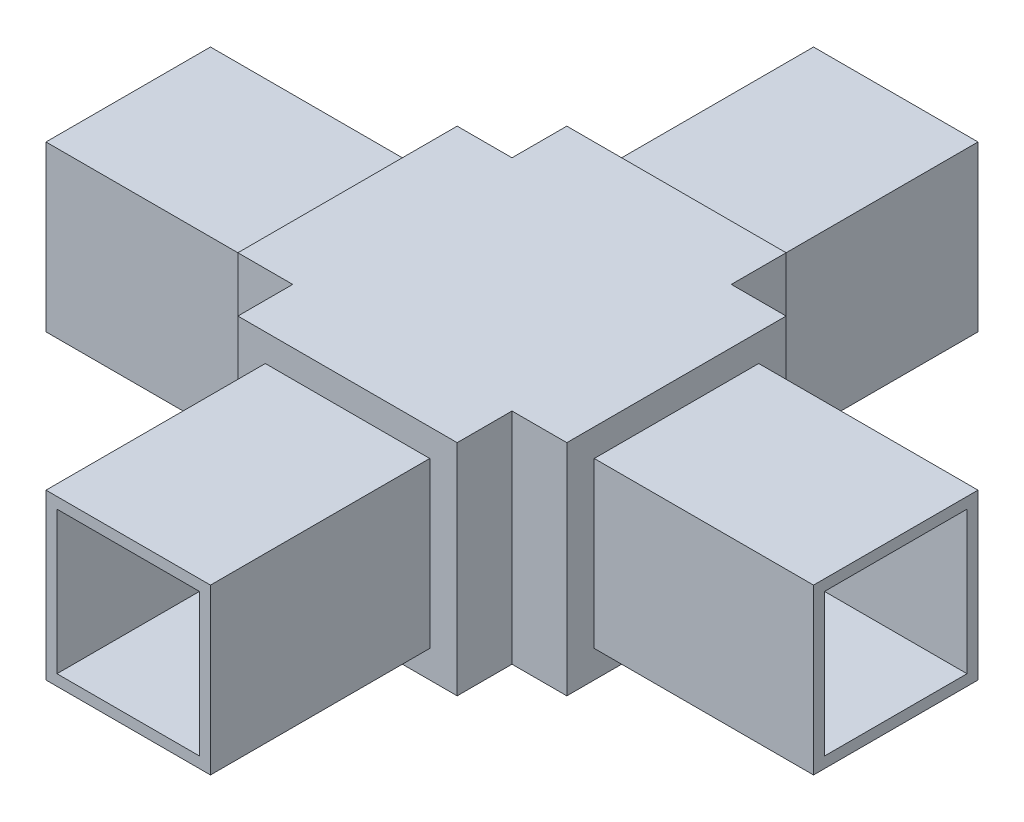
from build123d import *

# Parameters (mm, degrees)
CROQUIS1_W     = 40
CROQUIS1_H     = 50
CROQUIS1_H_2   = 40
CROQUIS1_W_2   = 50
EXTRUIR1_DEPTH = 40
CROQUIS2_W     = 40
CROQUIS2_H     = 40
CROQUIS2_W_2   = 30
CROQUIS2_H_2   = 30
EXTRUIR2_DEPTH = 40
CROQUIS3_W     = 40
CROQUIS3_H     = 40
CROQUIS3_W_2   = 30
CROQUIS3_H_2   = 30
EXTRUIR3_DEPTH = 40
CROQUIS5_W     = 40
CROQUIS5_H     = 40
CROQUIS5_W_2   = 30
CROQUIS5_H_2   = 30
EXTRUIR4_DEPTH = 40
CROQUIS6_W     = 40
CROQUIS6_H     = 40
CROQUIS6_W_2   = 30
CROQUIS6_H_2   = 30
EXTRUIR5_DEPTH = 40
VACIADO1_T     = -2


with BuildPart() as part:
    # Croquis1 → Extruir1 (new body)
    with BuildSketch(Plane(origin=(0, 0, 0), x_dir=(1, 0, 0), z_dir=(0, 1, 0))):
        with Locations((0, 45)):
            Rectangle(CROQUIS1_W, CROQUIS1_H)
        Rectangle(CROQUIS1_W, CROQUIS1_H_2)
        with Locations((45, 0)):
            Rectangle(CROQUIS1_W_2, CROQUIS1_H_2)
        with Locations((-45, 0)):
            Rectangle(CROQUIS1_W_2, CROQUIS1_H_2)
        with Locations((0, -45)):
            Rectangle(CROQUIS1_W, CROQUIS1_H)
    extrude(amount=EXTRUIR1_DEPTH)

    # Croquis2 → Extruir2 (cut)
    with BuildSketch(Plane(origin=(70, 0, 0), x_dir=(0, 0, -1), z_dir=(1, 0, 0))):
        with Locations((0, 20)):
            Rectangle(CROQUIS2_W, CROQUIS2_H)
        with Locations((0, 20)):
            Rectangle(CROQUIS2_W_2, CROQUIS2_H_2, mode=Mode.SUBTRACT)
    extrude(amount=-EXTRUIR2_DEPTH, mode=Mode.SUBTRACT)

    # Croquis3 → Extruir3 (cut)
    with BuildSketch(Plane(origin=(0, 0, -70), x_dir=(-1, 0, 0), z_dir=(0, 0, -1))):
        with Locations((0, 20)):
            Rectangle(CROQUIS3_W, CROQUIS3_H)
        with Locations((0, 20)):
            Rectangle(CROQUIS3_W_2, CROQUIS3_H_2, mode=Mode.SUBTRACT)
    extrude(amount=-EXTRUIR3_DEPTH, mode=Mode.SUBTRACT)

    # Croquis5 → Extruir4 (cut)
    with BuildSketch(Plane.ZY.offset(70)):
        with Locations((0, 20)):
            Rectangle(CROQUIS5_W, CROQUIS5_H)
        with Locations((0, 20)):
            Rectangle(CROQUIS5_W_2, CROQUIS5_H_2, mode=Mode.SUBTRACT)
    extrude(amount=-EXTRUIR4_DEPTH, mode=Mode.SUBTRACT)

    # Croquis6 → Extruir5 (cut)
    with BuildSketch(Plane.XY.offset(70)):
        with Locations((0, 20)):
            Rectangle(CROQUIS6_W, CROQUIS6_H)
        with Locations((0, 20)):
            Rectangle(CROQUIS6_W_2, CROQUIS6_H_2, mode=Mode.SUBTRACT)
    extrude(amount=-EXTRUIR5_DEPTH, mode=Mode.SUBTRACT)

    # Vaciado1
    vaciado1_openings = [part.faces().sort_by_distance(p)[0] for p in [
        (0, 20, 70),
        (70, 20, 0),
        (0, 20, -70),
        (-70, 20, 0),
    ]]
    offset(amount=VACIADO1_T, openings=vaciado1_openings, kind=Kind.INTERSECTION)


solid = part.part
